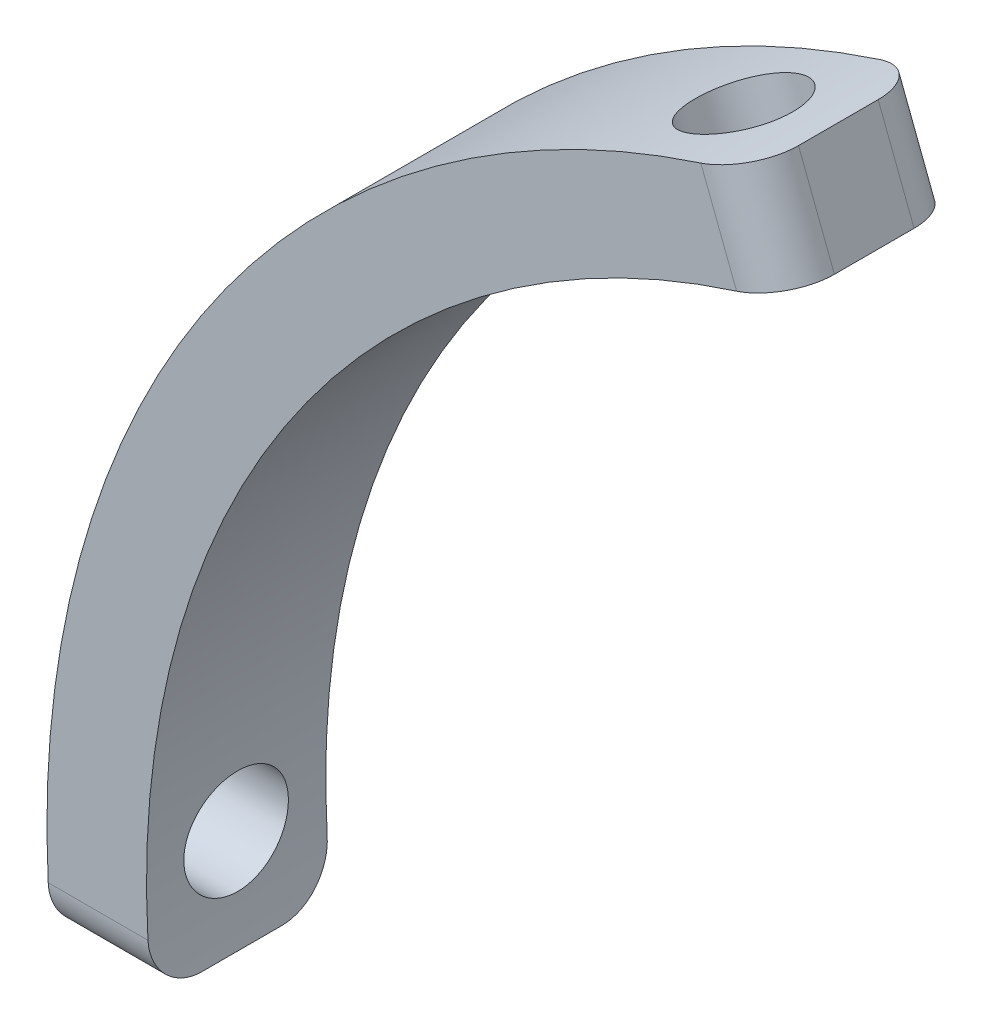
from build123d import *

# Parameters (mm, degrees)
BOSS_EXTRUDE3_DEPTH = 9
SKETCH5_R           = 5.25
CUT_EXTRUDE4_DEPTH  = 18
SKETCH6_R           = 5.25
CUT_EXTRUDE5_DEPTH  = 18
FILLET1_R           = 5


with BuildPart() as part:
    # Sketch1 → Boss-Extrude3 (new, symmetric)
    with BuildSketch(Plane.XY):
        with BuildLine():
            Line((-24.520010838, 91.781093197), (-20.91393225, 82.386937301))
            ThreePointArc((-20.91393225, 82.386937301), (-70.050726033, 48.144530139), (-84.409715081, -10))
            Line((-84.409715081, -10), (-94.472218138, -10))
            ThreePointArc((-94.472218138, -10), (-78.291987919, 53.808592508), (-24.520010838, 91.781093197))
        make_face()
    extrude(amount=BOSS_EXTRUDE3_DEPTH, both=True)

    # Sketch5 → Cut-Extrude4 (cut)
    with BuildSketch(Plane(origin=(-34.044955207, 88.690140517, 0), x_dir=(0.9335804264972001, 0.35836794954530493, 0), z_dir=(-0.35836794954530493, 0.9335804264972001, 0))):
        with Locations(Location((0, 0, 0), (0, 0, 180))):
            Circle(SKETCH5_R)
    extrude(amount=-CUT_EXTRUDE4_DEPTH, mode=Mode.SUBTRACT)

    # Sketch6 → Cut-Extrude5 (cut)
    with BuildSketch(Plane.ZY.offset(95)):
        Circle(SKETCH6_R)
    extrude(amount=-CUT_EXTRUDE5_DEPTH, mode=Mode.SUBTRACT)

    # Fillet1
    fillet1_edges = [part.edges().sort_by_distance(p)[0] for p in [
        (-89.44096661, -10, 9),
        (-89.44096661, -10, -9),
        (-22.716971544, 87.084015249, -9),
        (-22.716971544, 87.084015249, 9),
    ]]
    fillet(fillet1_edges, radius=FILLET1_R)


solid = part.part
